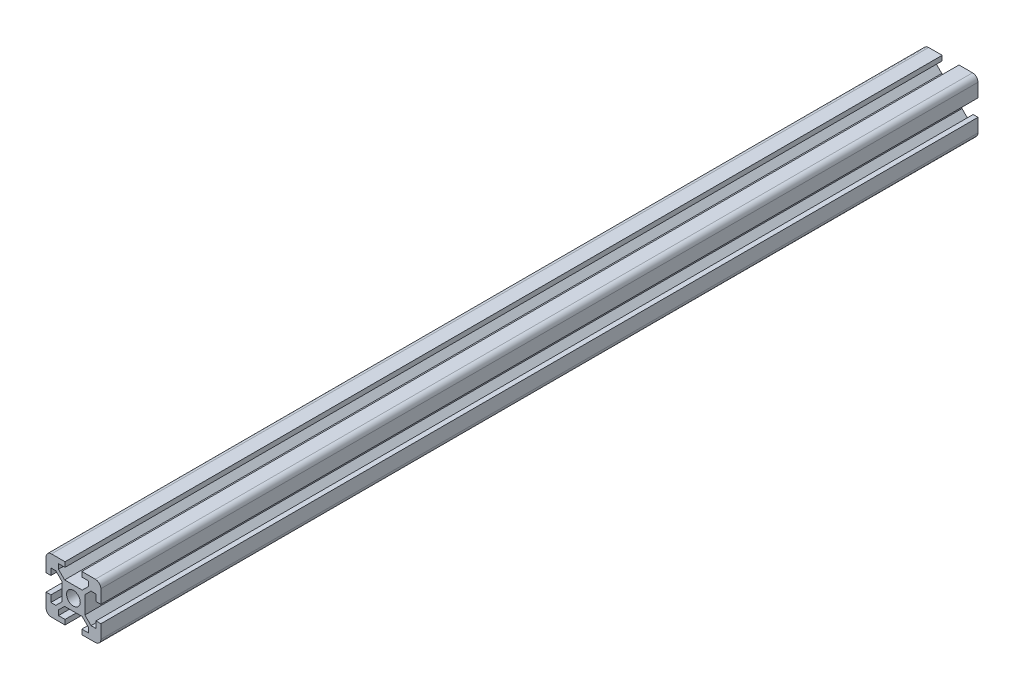
from build123d import *

# Parameters (mm, degrees)
SKETCH1_R           = 2.5
BOSS_EXTRUDE1_DEPTH = 320
FILLET1_R           = 2


with BuildPart() as part:
    # Sketch1 → Boss-Extrude1 (new body)
    with BuildSketch(Plane.XY):
        Polygon((-5.46, -6.42), (-3.215, -4.175), (3.215, -4.175), (5.46, -6.42), (5.46, -8.22), (3.06, -8.22), (3.06, -10), (10, -10), (10, -3.06), (8.22, -3.06), (8.22, -5.46), (6.42, -5.46), (4.175, -3.215), (4.175, 3.215), (6.42, 5.46), (8.22, 5.46), (8.22, 3.06), (10, 3.06), (10, 10), (3.06, 10), (3.06, 8.22), (5.46, 8.22), (5.46, 6.42), (3.215, 4.175), (-3.215, 4.175), (-5.46, 6.42), (-5.46, 8.22), (-3.06, 8.22), (-3.06, 10), (-10, 10), (-10, 3.06), (-8.22, 3.06), (-8.22, 5.46), (-6.42, 5.46), (-4.175, 3.215), (-4.175, -3.215), (-6.42, -5.46), (-8.22, -5.46), (-8.22, -3.06), (-10, -3.06), (-10, -10), (-3.06, -10), (-3.06, -8.22), (-5.46, -8.22), align=None)
        Circle(SKETCH1_R, mode=Mode.SUBTRACT)
    extrude(amount=BOSS_EXTRUDE1_DEPTH)

    # Fillet1
    fillet1_edges = [part.edges().sort_by_distance(p)[0] for p in [
        (10, -10, 160),
        (-10, -10, 160),
        (-10, 10, 160),
        (10, 10, 160),
    ]]
    fillet(fillet1_edges, radius=FILLET1_R)


solid = part.part
